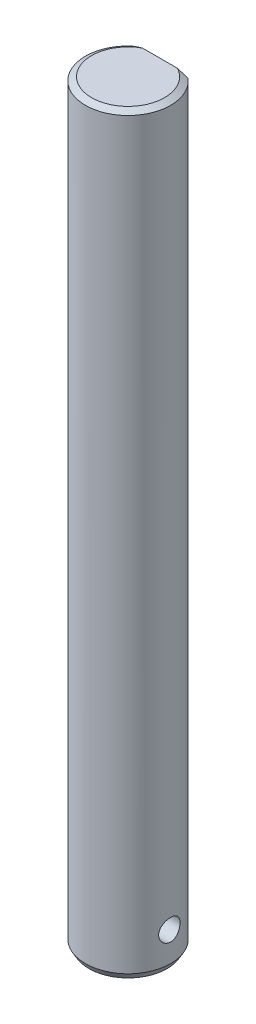
from build123d import *
from OCP.BRepFilletAPI import BRepFilletAPI_MakeChamfer

# Parameters (mm, degrees)
SKETCH1_R           = 6
BOSS_EXTRUDE1_DEPTH = 106
SKETCH2_W           = 10.423914885
SKETCH2_H           = 4.321024546
CUT_EXTRUDE1_DEPTH  = 10
SKETCH3_R           = 1.5
CUT_EXTRUDE2_DEPTH  = 20
CHAMFER1_SIZE       = 0.5
CHAMFER1_SIZE2      = 0.866025404


with BuildPart() as part:
    # Sketch1 → Boss-Extrude1 (new body)
    with BuildSketch(Plane(origin=(0, 0, 0), x_dir=(1, 0, 0), z_dir=(0, 1, 0))):
        with Locations(Location((0, 0, 0), (0, 0, 270))):
            Circle(SKETCH1_R)
    extrude(amount=BOSS_EXTRUDE1_DEPTH)

    # Sketch2 → Cut-Extrude1 (cut)
    with BuildSketch(Plane(origin=(0, 106, 0), x_dir=(1, 0, 0), z_dir=(0, 1, 0))):
        with Locations((-0.189323241, 6.660512273)):
            Rectangle(SKETCH2_W, SKETCH2_H)
    extrude(amount=-CUT_EXTRUDE1_DEPTH, mode=Mode.SUBTRACT)

    # Sketch3 → Cut-Extrude2 (cut, symmetric)
    with BuildSketch(Plane(origin=(0, 0, 0), x_dir=(0, 0, -1), z_dir=(1, 0, 0))):
        with Locations((0, 5)):
            Circle(SKETCH3_R)
    extrude(amount=CUT_EXTRUDE2_DEPTH, both=True, mode=Mode.SUBTRACT)

    # Chamfer1: one chamfer whose edges measure the first distance from different faces: ONE call of the kernel's chamfer builder (chamfer() names one face for all edges)
    chamfer1_edges_1 = [part.edges().sort_by_distance(p)[0] for p in [
        (0, 0, -6),
    ]]
    chamfer1_side_1 = [part.faces().sort_by_distance(p)[0] for p in [
        (0, 0, 0),
    ]]
    chamfer1_edges_2 = [part.edges().sort_by_distance(p)[0] for p in [
        (-5.61248608, 106, 2.121320344),
    ]]
    chamfer1_side_2 = [part.faces().sort_by_distance(p)[0] for p in [
        (0, 53, -6),
    ]]
    chamfer1 = BRepFilletAPI_MakeChamfer(part.part.solid().wrapped)
    for e in chamfer1_edges_1:
        chamfer1.Add(CHAMFER1_SIZE, CHAMFER1_SIZE2, e.wrapped, chamfer1_side_1[0].wrapped)  # the first distance lies on this face
    for e in chamfer1_edges_2:
        chamfer1.Add(CHAMFER1_SIZE, CHAMFER1_SIZE2, e.wrapped, chamfer1_side_2[0].wrapped)  # the first distance lies on this face
    add(Compound.cast(chamfer1.Shape()), mode=Mode.REPLACE)


solid = part.part
